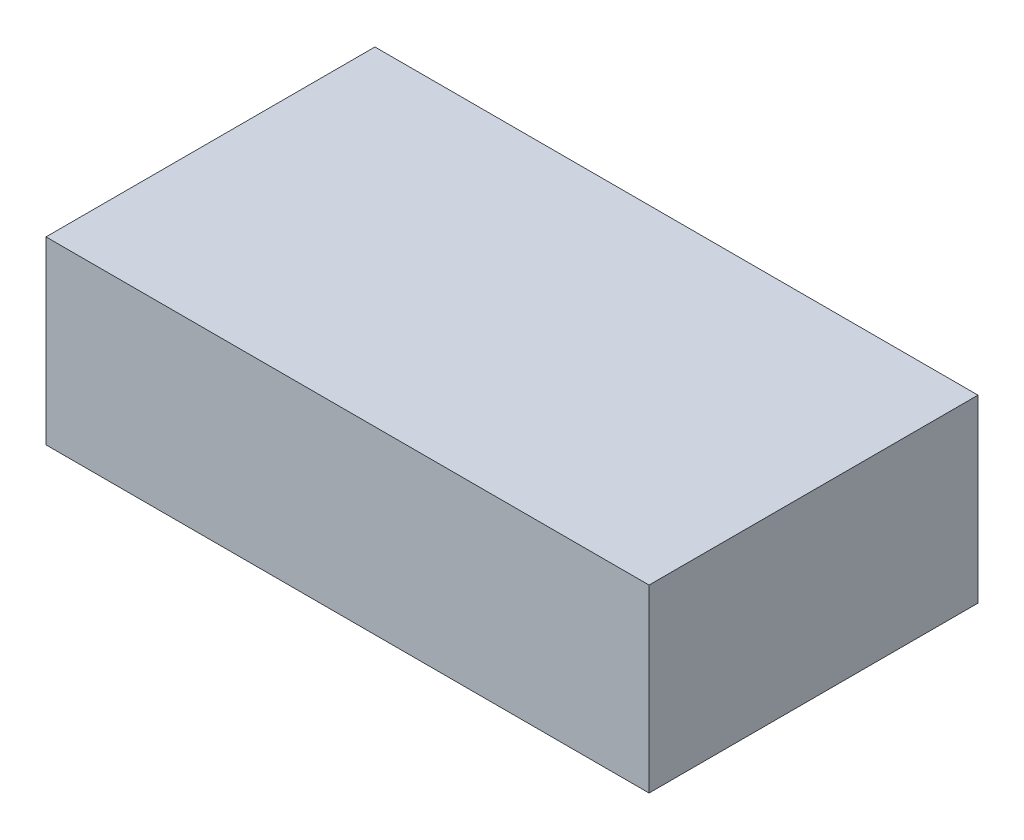
from build123d import *

# Parameters (mm, degrees)
SKETCH_1_W      = 77
SKETCH_1_H      = 42
EXTRUDE_1_DEPTH = 23


with BuildPart() as part:
    # 草图1 → 凸台-拉伸1 (new body)
    with BuildSketch(Plane(origin=(0, 0, 0), x_dir=(1, 0, 0), z_dir=(0, 1, 0))):
        Rectangle(SKETCH_1_W, SKETCH_1_H)
    extrude(amount=EXTRUDE_1_DEPTH)


solid = part.part
